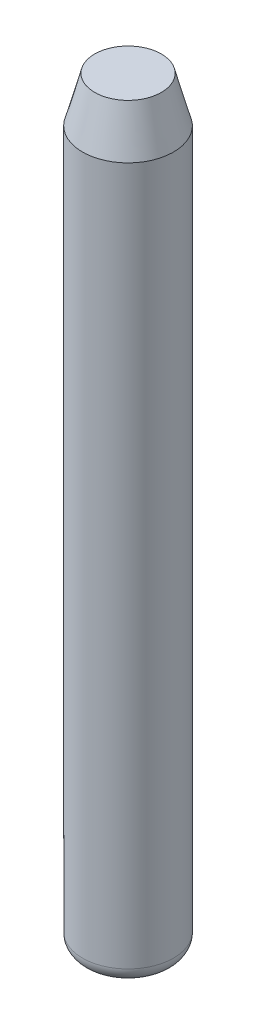
from build123d import *

# Parameters (mm, degrees)
SKETCH1_R           = 1.5
BOSS_EXTRUDE1_DEPTH = 25
CHAMFER1_SIZE       = 1.5
CHAMFER1_SIZE2      = 0.401923789
FILLET1_R           = 0.5


with BuildPart() as part:
    # Sketch1 → Boss-Extrude1 (new body)
    with BuildSketch(Plane(origin=(0, 0, 0), x_dir=(1, 0, 0), z_dir=(0, 1, 0))):
        with Locations(Location((0, 0, 0), (0, 0, 270))):
            Circle(SKETCH1_R)
    extrude(amount=BOSS_EXTRUDE1_DEPTH)

    # Chamfer1
    chamfer1_edges = [part.edges().sort_by_distance(p)[0] for p in [
        (0, 25, -1.5),
    ]]
    chamfer1_side = [part.faces().sort_by_distance(p)[0] for p in [
        (0, 12.5, -1.5),
    ]]
    chamfer(chamfer1_edges, length=CHAMFER1_SIZE, length2=CHAMFER1_SIZE2, reference=chamfer1_side[0])

    # Fillet1
    fillet1_edges = [part.edges().sort_by_distance(p)[0] for p in [
        (0, 0, -1.5),
    ]]
    fillet(fillet1_edges, radius=FILLET1_R)


solid = part.part
